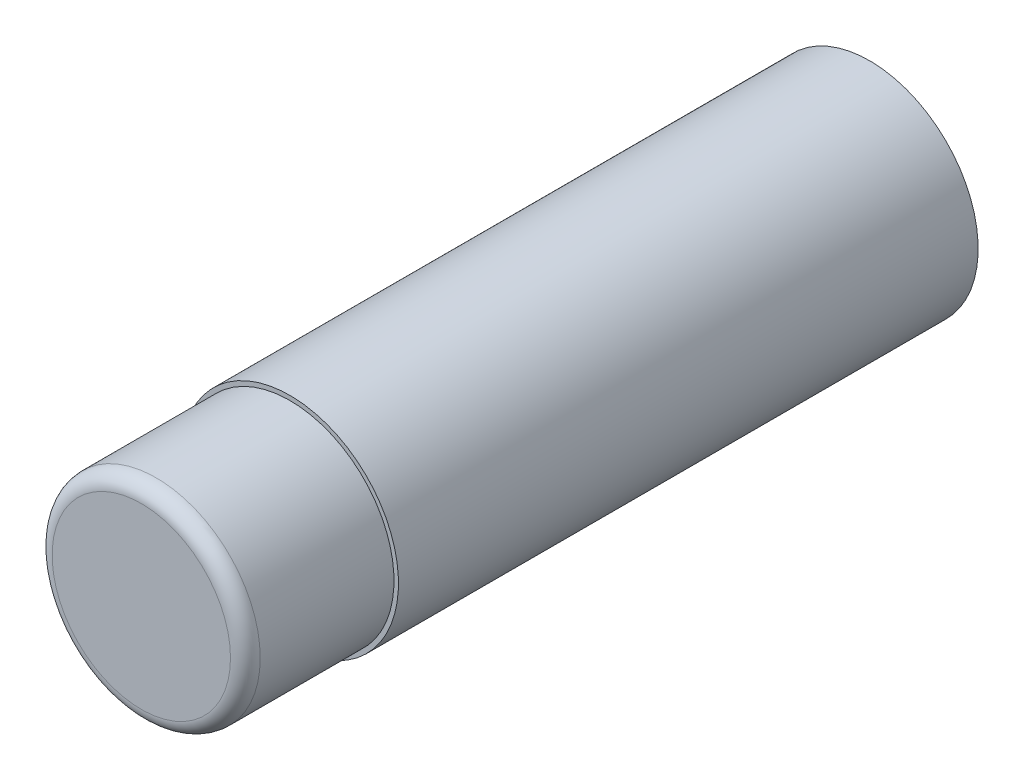
from build123d import *

# Parameters (mm, degrees)
SKIZZE1_R                       = 3.5
AUFSATZ_LINEAR_AUSTRAGEN1_DEPTH = 24.5
VERRUNDUNG1_R                   = 0.5
SKIZZE2_R                       = 3.65
AUFSATZ_LINEAR_AUSTRAGEN2_DEPTH = 19.5


with BuildPart() as part:
    # Skizze1 → Aufsatz-Linear austragen1 (new body)
    with BuildSketch(Plane.XY):
        Circle(SKIZZE1_R)
    extrude(amount=AUFSATZ_LINEAR_AUSTRAGEN1_DEPTH)

    # Verrundung1
    verrundung1_edges = [part.edges().sort_by_distance(p)[0] for p in [
        (-3.5, 0, 24.5),
    ]]
    fillet(verrundung1_edges, radius=VERRUNDUNG1_R)

    # Skizze2 → Aufsatz-Linear austragen2 (add)
    with BuildSketch(Plane(origin=(0, 0, 0), x_dir=(-1, 0, 0), z_dir=(0, 0, -1))):
        Circle(SKIZZE2_R)
    extrude(amount=-AUFSATZ_LINEAR_AUSTRAGEN2_DEPTH)


solid = part.part
